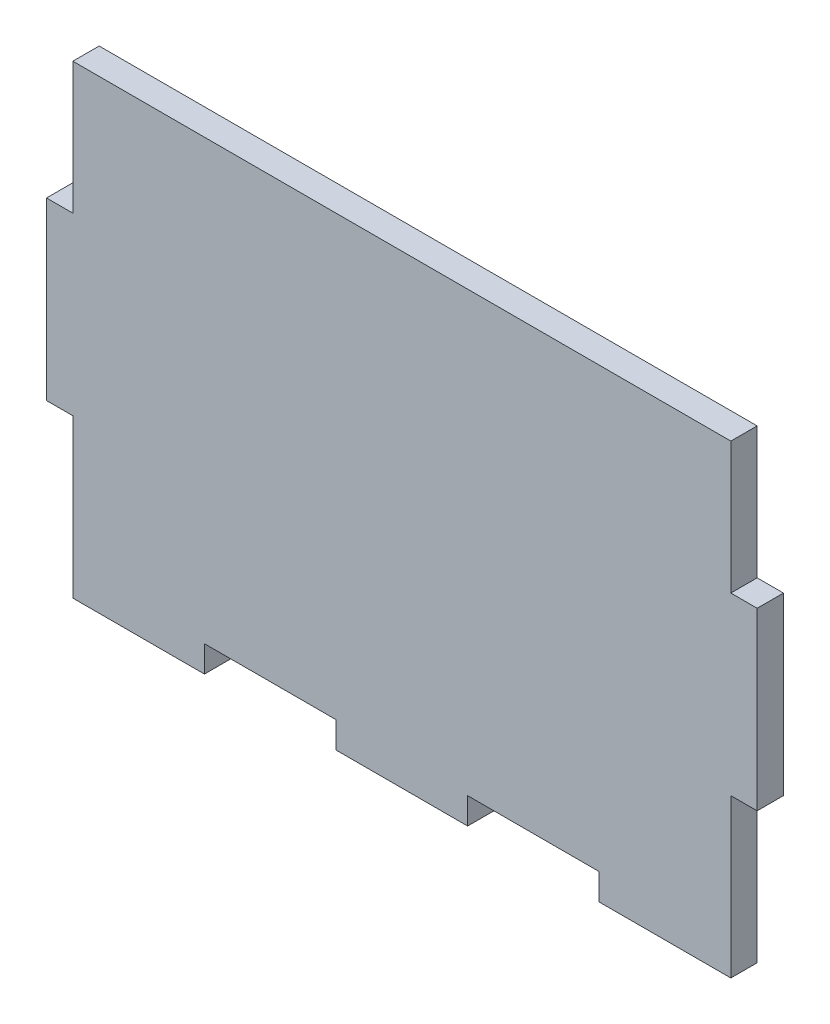
from build123d import *

# Parameters (mm, degrees)
ESBO_O1_W                = 150
ESBO_O1_H                = 100
RESSALTO_EXTRUS_O3_DEPTH = 6
ESBO_O3_W                = 30
ESBO_O3_H                = 6
RESSALTO_EXTRUS_O5_DEPTH = 6
ESBO_O4_W                = 6
ESBO_O4_H                = 40
RESSALTO_EXTRUS_O6_DEPTH = 6
ESBO_O5_W                = 6
ESBO_O5_H                = 40
RESSALTO_EXTRUS_O7_DEPTH = 6


with BuildPart() as part:
    # Esboço1 → Ressalto-extrusão3 (new body)
    with BuildSketch(Plane.XY):
        Rectangle(ESBO_O1_W, ESBO_O1_H)
    extrude(amount=RESSALTO_EXTRUS_O3_DEPTH)

    # Esboço3 → Ressalto-extrusão5 (add)
    with BuildSketch(Plane.XZ.offset(50)):
        with Locations((-60, 3)):
            Rectangle(ESBO_O3_W, ESBO_O3_H)
        with Locations((0, 3)):
            Rectangle(ESBO_O3_W, ESBO_O3_H)
        with Locations((60, 3)):
            Rectangle(ESBO_O3_W, ESBO_O3_H)
    extrude(amount=RESSALTO_EXTRUS_O5_DEPTH)

    # Esboço4 → Ressalto-extrusão6 (add)
    with BuildSketch(Plane(origin=(75, 0, 0), x_dir=(0, 0, -1), z_dir=(1, 0, 0))):
        with Locations((-3, 0)):
            Rectangle(ESBO_O4_W, ESBO_O4_H)
    extrude(amount=RESSALTO_EXTRUS_O6_DEPTH)

    # Esboço5 → Ressalto-extrusão7 (add)
    with BuildSketch(Plane.ZY.offset(75)):
        with Locations((3, 0)):
            Rectangle(ESBO_O5_W, ESBO_O5_H)
    extrude(amount=RESSALTO_EXTRUS_O7_DEPTH)


solid = part.part
